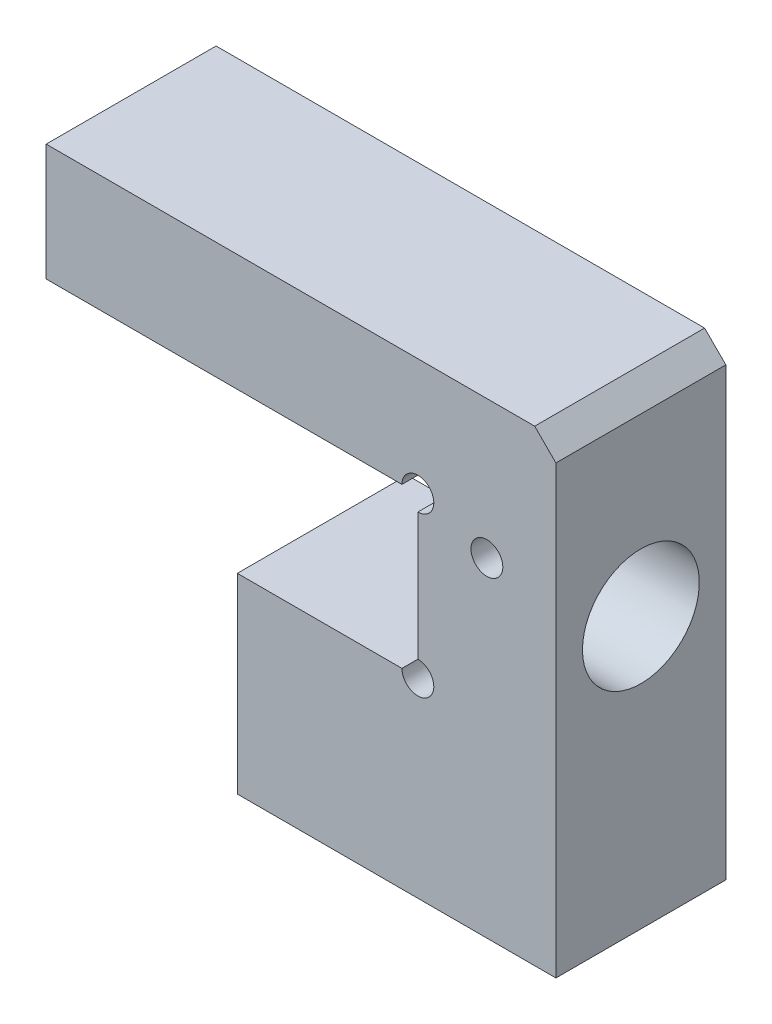
from build123d import *

# Parameters (mm, degrees)
ESBO_O1_R                = 1.5
RESSALTO_EXTRUS_O1_DEPTH = 16
CHANFRO1_SIZE            = 2
ESBO_O2_R                = 5.5
CORTE_EXTRUS_O1_DEPTH    = 59.455110983
ESBO_O5_R                = 3
CORTE_EXTRUS_O2_DEPTH    = 16


with BuildPart() as part:
    # Esboço1 → Ressalto-extrusão1 (new body)
    with BuildSketch(Plane.XY):
        with BuildLine():
            Line((48, 0), (0, 0))
            Line((0, 0), (0, -11))
            Line((0, -11), (33.5, -11))
            ThreePointArc((33.5, -11), (35, -9.5), (36.5, -11))
            ThreePointArc((36.5, -11), (36.060660172, -12.060660172), (35, -12.5))
            Line((35, -12.5), (35, -24.5))
            ThreePointArc((35, -24.5), (36.060660172, -24.939339828), (36.5, -26))
            ThreePointArc((36.5, -26), (35, -27.5), (33.5, -26))
            Line((33.5, -26), (18, -26))
            Line((18, -26), (18, -44))
            Line((18, -44), (48, -44))
            Line((48, -44), (48, 0))
        make_face()
        with Locations((41.5, -13)):
            Circle(ESBO_O1_R, mode=Mode.SUBTRACT)
    extrude(amount=RESSALTO_EXTRUS_O1_DEPTH)

    # Chanfro1
    chanfro1_edges = [part.edges().sort_by_distance(p)[0] for p in [
        (48, 0, 8),
    ]]
    chamfer(chanfro1_edges, length=CHANFRO1_SIZE)

    # Esboço2 → Corte-extrusão1 (cut, through all)
    with BuildSketch(Plane.ZY.offset(-35)):
        with Locations((8, -18.5)):
            Circle(ESBO_O2_R)
    extrude(amount=-CORTE_EXTRUS_O1_DEPTH, mode=Mode.SUBTRACT)

    # Esboço5 → Corte-extrusão2 (cut)
    with BuildSketch(Plane.XZ.offset(44)):
        with Locations(Location((41.5, 8, 0), (0, 0, 270))):
            Circle(ESBO_O5_R)
    extrude(amount=-CORTE_EXTRUS_O2_DEPTH, mode=Mode.SUBTRACT)


solid = part.part
